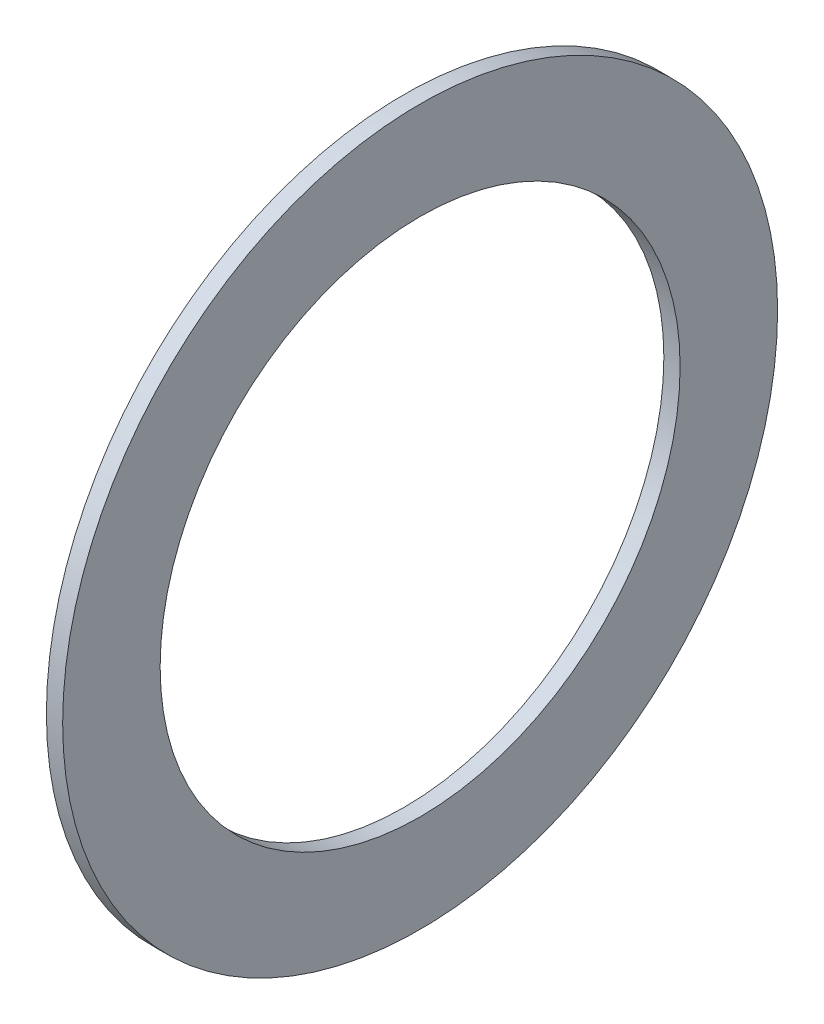
from build123d import *

# Parameters (mm, degrees)
SKETCH1_R           = 5.5
SKETCH1_R_2         = 4
BOSS_EXTRUDE1_DEPTH = 0.25


with BuildPart() as part:
    # Sketch1 → Boss-Extrude1 (new body)
    with BuildSketch(Plane(origin=(0, 0, 0), x_dir=(0, 0, -1), z_dir=(1, 0, 0))):
        Circle(SKETCH1_R)
        Circle(SKETCH1_R_2, mode=Mode.SUBTRACT)
    extrude(amount=BOSS_EXTRUDE1_DEPTH)


solid = part.part
